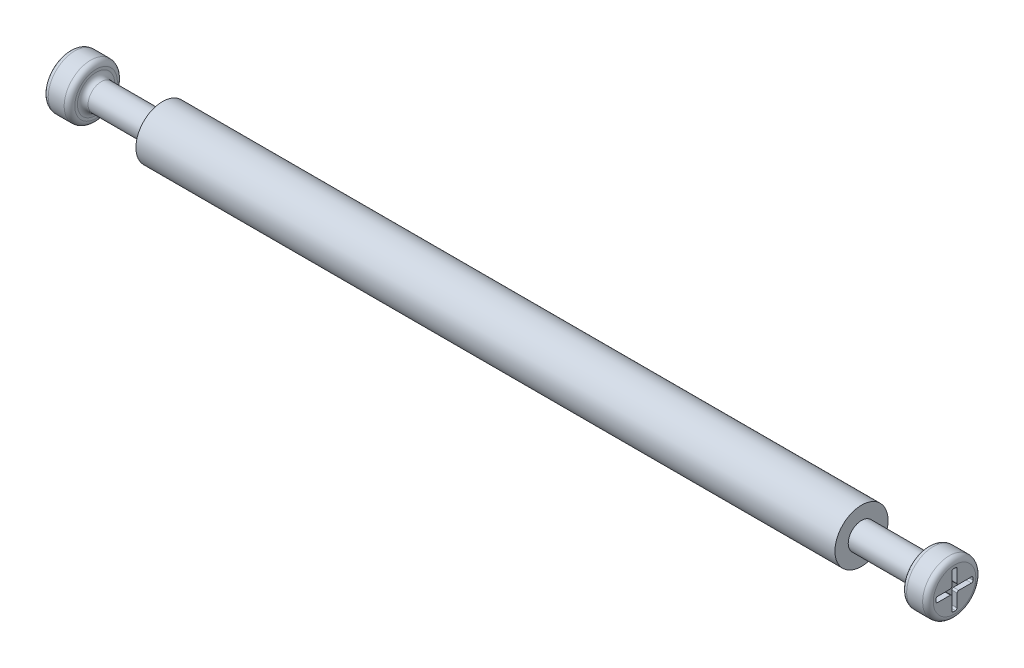
from build123d import *

# Parameters (mm, degrees)
BOSS_EXTRUDE1_DEPTH      = 167.005
BOSS_EXTRUDE1_DEPTH_BACK = 167.005
SKETCH1_R                = 12.7
SKETCH2_R                = 6.35
BOSS_EXTRUDE2_DEPTH      = 31.75
SKETCH3_R                = 12.7
BOSS_EXTRUDE3_DEPTH      = 12.7
FILLET1_R                = 2.54
CUT_EXTRUDE1_DEPTH       = 2.54
FILLET2_R                = 2.54
CUT_EXTRUDE2_DEPTH       = 2.54


with BuildPart() as part:
    # Sketch1 → Boss-Extrude1 (new, two sides: drawn at the far end of the back side and taken through both)
    with BuildSketch(Plane(origin=(0, 0, 0), x_dir=(0, 0, -1), z_dir=(1, 0, 0)).offset(-BOSS_EXTRUDE1_DEPTH_BACK)):
        Circle(SKETCH1_R)
    extrude(amount=BOSS_EXTRUDE1_DEPTH + BOSS_EXTRUDE1_DEPTH_BACK)

    # Sketch2 → Boss-Extrude2 (add)
    with BuildSketch(Plane.ZY.offset(167.005)):
        Circle(SKETCH2_R)
    boss_extrude2 = extrude(amount=BOSS_EXTRUDE2_DEPTH)

    # Sketch3 → Boss-Extrude3 (add)
    with BuildSketch(Plane.ZY.offset(198.755)):
        Circle(SKETCH3_R)
    boss_extrude3 = extrude(amount=BOSS_EXTRUDE3_DEPTH)

    # Fillet1
    fillet1_edges = [part.edges().sort_by_distance(p)[0] for p in [
        (-211.455, 0, -12.7),
        (-198.755, 0, -12.7),
        (-198.755, 0, -6.35),
    ]]
    fillet(fillet1_edges, radius=FILLET1_R)

    # Sketch4 → Cut-Extrude1 (cut)
    with BuildSketch(Plane.ZY.offset(211.455)):
        with BuildLine():
            Line((-0.553600339, 9.075313461), (0.462399661, 9.075313461))
            ThreePointArc((0.462399661, 9.075313461), (1.001215029, 8.852128828), (1.224399661, 8.313313461))
            Line((1.224399661, 8.313313461), (1.224399661, 2.217313461))
            ThreePointArc((1.224399661, 2.217313461), (1.447584294, 1.678498093), (1.986399661, 1.455313461))
            Line((1.986399661, 1.455313461), (8.082399661, 1.455313461))
            ThreePointArc((8.082399661, 1.455313461), (8.621215029, 1.232128828), (8.844399661, 0.693313461))
            Line((8.844399661, 0.693313461), (8.844399661, -0.322686539))
            ThreePointArc((8.844399661, -0.322686539), (8.621215029, -0.861501907), (8.082399661, -1.084686539))
            Line((8.082399661, -1.084686539), (1.986399661, -1.084686539))
            ThreePointArc((1.986399661, -1.084686539), (1.447584294, -1.307871172), (1.224399661, -1.846686539))
            Line((1.224399661, -1.846686539), (1.224399661, -7.942686539))
            ThreePointArc((1.224399661, -7.942686539), (1.001215029, -8.481501907), (0.462399661, -8.704686539))
            Line((0.462399661, -8.704686539), (-0.553600339, -8.704686539))
            ThreePointArc((-0.553600339, -8.704686539), (-1.092415706, -8.481501907), (-1.315600339, -7.942686539))
            Line((-1.315600339, -7.942686539), (-1.315600339, -1.846686539))
            ThreePointArc((-1.315600339, -1.846686539), (-1.538784971, -1.307871172), (-2.077600339, -1.084686539))
            Line((-2.077600339, -1.084686539), (-8.173600339, -1.084686539))
            ThreePointArc((-8.173600339, -1.084686539), (-8.712415706, -0.861501907), (-8.935600339, -0.322686539))
            Line((-8.935600339, -0.322686539), (-8.935600339, 0.693313461))
            ThreePointArc((-8.935600339, 0.693313461), (-8.712415706, 1.232128828), (-8.173600339, 1.455313461))
            Line((-8.173600339, 1.455313461), (-2.077600339, 1.455313461))
            ThreePointArc((-2.077600339, 1.455313461), (-1.538784971, 1.678498093), (-1.315600339, 2.217313461))
            Line((-1.315600339, 2.217313461), (-1.315600339, 8.313313461))
            ThreePointArc((-1.315600339, 8.313313461), (-1.092415706, 8.852128828), (-0.553600339, 9.075313461))
        make_face()
    extrude(amount=-CUT_EXTRUDE1_DEPTH, mode=Mode.SUBTRACT)

    # Mirror1: Boss-Extrude2, Boss-Extrude3 across plane
    add(boss_extrude2.mirror(Plane(origin=(0, 0, 0), x_dir=(0, 0, 1), z_dir=(1, 0, 0))))
    add(boss_extrude3.mirror(Plane(origin=(0, 0, 0), x_dir=(0, 0, 1), z_dir=(1, 0, 0))))

    # Fillet2
    fillet2_edges = [part.edges().sort_by_distance(p)[0] for p in [
        (198.755, 0, -6.35),
        (198.755, 0, -12.7),
        (211.455, 0, -12.7),
    ]]
    fillet(fillet2_edges, radius=FILLET2_R)

    # Sketch5 → Cut-Extrude2 (cut)
    with BuildSketch(Plane(origin=(211.455, 0, 0), x_dir=(0, 0, -1), z_dir=(1, 0, 0))):
        with BuildLine():
            Line((-0.545062692, 8.815874616), (0.470937308, 8.815874616))
            ThreePointArc((0.470937308, 8.815874616), (1.009752675, 8.592689983), (1.232937308, 8.053874616))
            Line((1.232937308, 8.053874616), (1.232937308, 1.957874616))
            ThreePointArc((1.232937308, 1.957874616), (1.456121941, 1.419059249), (1.994937308, 1.195874616))
            Line((1.994937308, 1.195874616), (8.090937308, 1.195874616))
            ThreePointArc((8.090937308, 1.195874616), (8.629752675, 0.972689983), (8.852937308, 0.433874616))
            Line((8.852937308, 0.433874616), (8.852937308, -0.582125384))
            ThreePointArc((8.852937308, -0.582125384), (8.629752675, -1.120940751), (8.090937308, -1.344125384))
            Line((8.090937308, -1.344125384), (1.994937308, -1.344125384))
            ThreePointArc((1.994937308, -1.344125384), (1.456121941, -1.567310017), (1.232937308, -2.106125384))
            Line((1.232937308, -2.106125384), (1.232937308, -8.202125384))
            ThreePointArc((1.232937308, -8.202125384), (1.009752675, -8.740940751), (0.470937308, -8.964125384))
            Line((0.470937308, -8.964125384), (-0.545062692, -8.964125384))
            ThreePointArc((-0.545062692, -8.964125384), (-1.083878059, -8.740940751), (-1.307062692, -8.202125384))
            Line((-1.307062692, -8.202125384), (-1.307062692, -2.106125384))
            ThreePointArc((-1.307062692, -2.106125384), (-1.530247325, -1.567310017), (-2.069062692, -1.344125384))
            Line((-2.069062692, -1.344125384), (-8.165062692, -1.344125384))
            ThreePointArc((-8.165062692, -1.344125384), (-8.703878059, -1.120940751), (-8.927062692, -0.582125384))
            Line((-8.927062692, -0.582125384), (-8.927062692, 0.433874616))
            ThreePointArc((-8.927062692, 0.433874616), (-8.703878059, 0.972689983), (-8.165062692, 1.195874616))
            Line((-8.165062692, 1.195874616), (-2.069062692, 1.195874616))
            ThreePointArc((-2.069062692, 1.195874616), (-1.530247325, 1.419059249), (-1.307062692, 1.957874616))
            Line((-1.307062692, 1.957874616), (-1.307062692, 8.053874616))
            ThreePointArc((-1.307062692, 8.053874616), (-1.083878059, 8.592689983), (-0.545062692, 8.815874616))
        make_face()
    extrude(amount=-CUT_EXTRUDE2_DEPTH, mode=Mode.SUBTRACT)


solid = part.part
